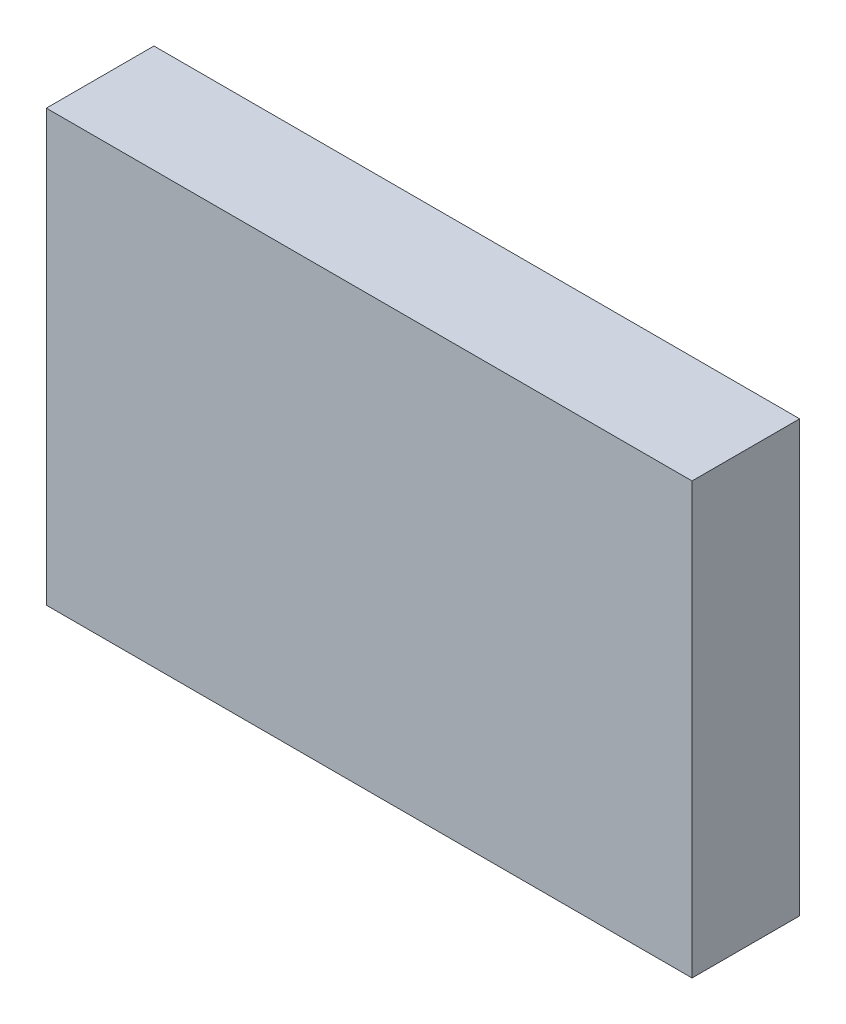
from build123d import *

# Parameters (mm, degrees)
SKETCH3_W           = 30
SKETCH3_H           = 20
BOSS_EXTRUDE1_DEPTH = 5


with BuildPart() as part:
    # Sketch3 → Boss-Extrude1 (new body)
    with BuildSketch(Plane.XY):
        Rectangle(SKETCH3_W, SKETCH3_H)
    extrude(amount=BOSS_EXTRUDE1_DEPTH)


solid = part.part
